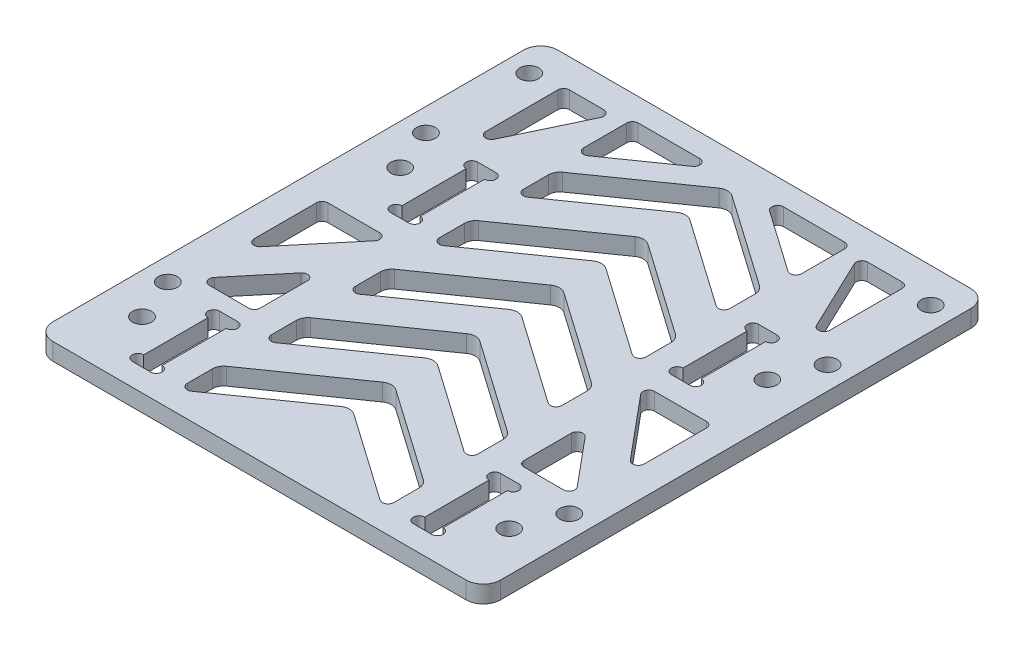
from build123d import *

# Parameters (mm, degrees)
SKETCH_1_R          = 1.65
SKETCH_1_W          = 3.2
SKETCH_1_H          = 15.2
EXTRUDE_1_DEPTH     = 3
SKETCH_2_R          = 1
CUT_EXTRUDE_1_DEPTH = 10
CUT_EXTRUDE_2_DEPTH = 10
CUT_EXTRUDE_4_DEPTH = 10
FILLET_3_R          = 1
FILLET_4_R          = 2


with BuildPart() as part:
    # 草图1 → 凸台-拉伸1 (new body)
    with BuildSketch(Plane(origin=(0, 0, 0), x_dir=(1, 0, 0), z_dir=(0, 1, 0))):
        with BuildLine():
            Line((-36, -34), (36, -34))
            ThreePointArc((36, -34), (38.121320344, -33.121320344), (39, -31))
            Line((39, -31), (39, 51))
            ThreePointArc((39, 51), (38.121320344, 53.121320344), (36, 54))
            Line((36, 54), (-36, 54))
            ThreePointArc((-36, 54), (-38.121320344, 53.121320344), (-39, 51))
            Line((-39, 51), (-39, -31))
            ThreePointArc((-39, -31), (-38.121320344, -33.121320344), (-36, -34))
        make_face()
        with Locations(Location((-32, 22.5, 0), (0, 0, 270))):
            Circle(SKETCH_1_R, mode=Mode.SUBTRACT)
        with Locations(Location((32, 22.5, 0), (0, 0, 270))):
            Circle(SKETCH_1_R, mode=Mode.SUBTRACT)
        with Locations(Location((32, -22.5, 0), (0, 0, 270))):
            Circle(SKETCH_1_R, mode=Mode.SUBTRACT)
        with Locations(Location((-32, -22.5, 0), (0, 0, 270))):
            Circle(SKETCH_1_R, mode=Mode.SUBTRACT)
        with Locations(Location((-35, 48, 0), (0, 0, 270))):
            Circle(SKETCH_1_R, mode=Mode.SUBTRACT)
        with Locations(Location((35, 48, 0), (0, 0, 270))):
            Circle(SKETCH_1_R, mode=Mode.SUBTRACT)
        with Locations(Location((-35, 30, 0), (0, 0, 270))):
            Circle(SKETCH_1_R, mode=Mode.SUBTRACT)
        with Locations(Location((35, 30, 0), (0, 0, 270))):
            Circle(SKETCH_1_R, mode=Mode.SUBTRACT)
        with Locations(Location((35, -15, 0), (0, 0, 270))):
            Circle(SKETCH_1_R, mode=Mode.SUBTRACT)
        with Locations(Location((-35, -15, 0), (0, 0, 270))):
            Circle(SKETCH_1_R, mode=Mode.SUBTRACT)
        with Locations((24.5, 22.5)):
            Rectangle(SKETCH_1_W, SKETCH_1_H, mode=Mode.SUBTRACT)
        with Locations((-24.5, 22.5)):
            Rectangle(SKETCH_1_W, SKETCH_1_H, mode=Mode.SUBTRACT)
        with Locations((24.5, -22.5)):
            Rectangle(SKETCH_1_W, SKETCH_1_H, mode=Mode.SUBTRACT)
        with Locations((-24.5, -22.5)):
            Rectangle(SKETCH_1_W, SKETCH_1_H, mode=Mode.SUBTRACT)
    extrude(amount=EXTRUDE_1_DEPTH)

    # 草图2 → 切除-拉伸1 (cut)
    with BuildSketch(Plane(origin=(0, 3, 0), x_dir=(1, 0, 0), z_dir=(0, 1, 0))):
        with Locations((-22.9, -29.1)):
            Circle(SKETCH_2_R)
        with Locations((-26.1, -29.1)):
            Circle(SKETCH_2_R)
        with Locations((-22.9, -15.9)):
            Circle(SKETCH_2_R)
        with Locations((-26.1, -15.9)):
            Circle(SKETCH_2_R)
        with Locations((26.1, -15.9)):
            Circle(SKETCH_2_R)
        with Locations((22.9, -15.9)):
            Circle(SKETCH_2_R)
        with Locations((26.1, -29.1)):
            Circle(SKETCH_2_R)
        with Locations((22.9, -29.1)):
            Circle(SKETCH_2_R)
        with Locations((22.9, 29.1)):
            Circle(SKETCH_2_R)
        with Locations((26.1, 29.1)):
            Circle(SKETCH_2_R)
        with Locations((22.9, 15.9)):
            Circle(SKETCH_2_R)
        with Locations((26.1, 15.9)):
            Circle(SKETCH_2_R)
        with Locations((-26.1, 15.9)):
            Circle(SKETCH_2_R)
        with Locations((-22.9, 15.9)):
            Circle(SKETCH_2_R)
        with Locations((-26.1, 29.1)):
            Circle(SKETCH_2_R)
        with Locations((-22.9, 29.1)):
            Circle(SKETCH_2_R)
    extrude(amount=-CUT_EXTRUDE_1_DEPTH, mode=Mode.SUBTRACT)

    # 草图3 → 切除-拉伸2 (cut)
    with BuildSketch(Plane.XZ):
        with BuildLine():
            Line((-30.864958387, 11.9), (-24, 11.9))
            ThreePointArc((-24, 11.9), (-23.292893219, 11.607106781), (-23, 10.9))
            Line((-23, 10.9), (-23, 2.662049935))
            ThreePointArc((-23, 2.662049935), (-23.659574736, 1.721778357), (-24.76822128, 2.021865536))
            Line((-24.76822128, 2.021865536), (-31.633179667, 10.2598156))
            ThreePointArc((-31.633179667, 10.2598156), (-31.770547809, 11.324155396), (-30.864958387, 11.9))
        make_face()
        with BuildLine():
            Line((-32.23177872, 1.605834853), (-23.177070009, -9.2598156))
            ThreePointArc((-23.177070009, -9.2598156), (-23.039701867, -10.324155396), (-23.945291289, -10.9))
            Line((-23.945291289, -10.9), (-33, -10.9))
            ThreePointArc((-33, -10.9), (-33.707106781, -10.607106781), (-34, -9.9))
            Line((-34, -9.9), (-34, 0.965650454))
            ThreePointArc((-34, 0.965650454), (-33.340425264, 1.905922031), (-32.23177872, 1.605834853))
        make_face()
        with BuildLine():
            Line((34, -9.9), (34, 0.965650454))
            ThreePointArc((34, 0.965650454), (33.340425264, 1.905922031), (32.23177872, 1.605834853))
            Line((32.23177872, 1.605834853), (23.177070009, -9.2598156))
            ThreePointArc((23.177070009, -9.2598156), (23.039701867, -10.324155396), (23.945291289, -10.9))
            Line((23.945291289, -10.9), (33, -10.9))
            ThreePointArc((33, -10.9), (33.707106781, -10.607106781), (34, -9.9))
        make_face()
        with BuildLine():
            Line((24.76822128, 2.021865536), (31.633179667, 10.2598156))
            ThreePointArc((31.633179667, 10.2598156), (31.770547809, 11.324155396), (30.864958387, 11.9))
            Line((30.864958387, 11.9), (24, 11.9))
            ThreePointArc((24, 11.9), (23.292893219, 11.607106781), (23, 10.9))
            Line((23, 10.9), (23, 2.662049935))
            ThreePointArc((23, 2.662049935), (23.659574736, 1.721778357), (24.76822128, 2.021865536))
        make_face()
        with BuildLine():
            Line((-28.097400841, -34.989212962), (-22.097400841, -47.569517993))
            ThreePointArc((-22.097400841, -47.569517993), (-22.154280777, -48.533628145), (-23, -49))
            Line((-23, -49), (-29, -49))
            ThreePointArc((-29, -49), (-29.707106781, -48.707106781), (-30, -48))
            Line((-30, -48), (-30, -35.419694969))
            ThreePointArc((-30, -35.419694969), (-29.220681718, -34.444349092), (-28.097400841, -34.989212962))
        make_face()
        with BuildLine():
            Line((23, -49), (29, -49))
            ThreePointArc((29, -49), (29.707106781, -48.707106781), (30, -48))
            Line((30, -48), (30, -35.419694969))
            ThreePointArc((30, -35.419694969), (29.220681718, -34.444349092), (28.097400841, -34.989212962))
            Line((28.097400841, -34.989212962), (22.097400841, -47.569517993))
            ThreePointArc((22.097400841, -47.569517993), (22.154280777, -48.533628145), (23, -49))
        make_face()
    extrude(amount=-CUT_EXTRUDE_2_DEPTH, mode=Mode.SUBTRACT)

    # 草图4 → 切除-拉伸4 (cut)
    with BuildSketch(Plane(origin=(0, 0, 0), x_dir=(-1, 0, 0), z_dir=(0, 1, 0))):
        Polygon((0, -48), (18, -35.396264312), (18, -28.07161678), (0, -40.675352467), (-18, -28.07161678), (-18, -35.396264312), align=None)
        with BuildLine():
            Line((18, -50), (7.289085971, -50))
            ThreePointArc((7.289085971, -50), (6.335369021, -49.3007058), (6.715509535, -48.180847956))
            Line((6.715509535, -48.180847956), (17.426423564, -40.680985212))
            ThreePointArc((17.426423564, -40.680985212), (18.461748613, -40.613126423), (19, -41.500137256))
            Line((19, -41.500137256), (19, -49))
            ThreePointArc((19, -49), (18.707106781, -49.707106781), (18, -50))
        make_face()
        with BuildLine():
            Line((-6.715509535, -48.180847956), (-17.426423564, -40.680985212))
            ThreePointArc((-17.426423564, -40.680985212), (-18.461748613, -40.613126423), (-19, -41.500137256))
            Line((-19, -41.500137256), (-19, -49))
            ThreePointArc((-19, -49), (-18.707106781, -49.707106781), (-18, -50))
            Line((-18, -50), (-7.289085971, -50))
            ThreePointArc((-7.289085971, -50), (-6.335369021, -49.3007058), (-6.715509535, -48.180847956))
        make_face()
        with BuildLine():
            Line((-17.147152873, -21.344139235), (-1.147152873, -32.547459846))
            ThreePointArc((-1.147152873, -32.547459846), (0, -32.909155757), (1.147152873, -32.547459846))
            Line((1.147152873, -32.547459846), (17.147152873, -21.344139235))
            ThreePointArc((17.147152873, -21.344139235), (17.774021666, -20.629332372), (18, -19.705835146))
            Line((18, -19.705835146), (18, -15.343303841))
            ThreePointArc((18, -15.343303841), (17.461748613, -14.456293008), (16.426423564, -14.524151797))
            Line((16.426423564, -14.524151797), (1.147152873, -25.222812313))
            ThreePointArc((1.147152873, -25.222812313), (0, -25.584508225), (-1.147152873, -25.222812313))
            Line((-1.147152873, -25.222812313), (-16.426423564, -14.524151797))
            ThreePointArc((-16.426423564, -14.524151797), (-17.461748613, -14.456293008), (-18, -15.343303841))
            Line((-18, -15.343303841), (-18, -19.705835146))
            ThreePointArc((-18, -19.705835146), (-17.774021666, -20.629332372), (-17.147152873, -21.344139235))
        make_face()
        with BuildLine():
            Line((-17.147152873, -6.694844169), (-1.147152873, -17.898164781))
            ThreePointArc((-1.147152873, -17.898164781), (0, -18.259860692), (1.147152873, -17.898164781))
            Line((1.147152873, -17.898164781), (17.147152873, -6.694844169))
            ThreePointArc((17.147152873, -6.694844169), (17.774021666, -5.980037307), (18, -5.056540081))
            Line((18, -5.056540081), (18, -0.694008776))
            ThreePointArc((18, -0.694008776), (17.461748613, 0.193002057), (16.426423564, 0.125143268))
            Line((16.426423564, 0.125143268), (1.147152873, -10.573517248))
            ThreePointArc((1.147152873, -10.573517248), (0, -10.93521316), (-1.147152873, -10.573517248))
            Line((-1.147152873, -10.573517248), (-16.426423564, 0.125143268))
            ThreePointArc((-16.426423564, 0.125143268), (-17.461748613, 0.193002057), (-18, -0.694008776))
            Line((-18, -0.694008776), (-18, -5.056540081))
            ThreePointArc((-18, -5.056540081), (-17.774021666, -5.980037307), (-17.147152873, -6.694844169))
        make_face()
        with BuildLine():
            Line((-17.147152873, 7.954450896), (-1.147152873, -3.248869716))
            ThreePointArc((-1.147152873, -3.248869716), (0, -3.610565627), (1.147152873, -3.248869716))
            Line((1.147152873, -3.248869716), (17.147152873, 7.954450896))
            ThreePointArc((17.147152873, 7.954450896), (17.774021666, 8.669257758), (18, 9.592754984))
            Line((18, 9.592754984), (18, 13.955286289))
            ThreePointArc((18, 13.955286289), (17.461748613, 14.842297122), (16.426423564, 14.774438333))
            Line((16.426423564, 14.774438333), (1.147152873, 4.075777817))
            ThreePointArc((1.147152873, 4.075777817), (0, 3.714081906), (-1.147152873, 4.075777817))
            Line((-1.147152873, 4.075777817), (-16.426423564, 14.774438333))
            ThreePointArc((-16.426423564, 14.774438333), (-17.461748613, 14.842297122), (-18, 13.955286289))
            Line((-18, 13.955286289), (-18, 9.592754984))
            ThreePointArc((-18, 9.592754984), (-17.774021666, 8.669257758), (-17.147152873, 7.954450896))
        make_face()
        with BuildLine():
            Line((-17.147152873, 22.603745961), (-1.147152873, 11.400425349))
            ThreePointArc((-1.147152873, 11.400425349), (0, 11.038729438), (1.147152873, 11.400425349))
            Line((1.147152873, 11.400425349), (17.147152873, 22.603745961))
            ThreePointArc((17.147152873, 22.603745961), (17.774021666, 23.318552823), (18, 24.242050049))
            Line((18, 24.242050049), (18, 28.604581354))
            ThreePointArc((18, 28.604581354), (17.461748613, 29.491592187), (16.426423564, 29.423733398))
            Line((16.426423564, 29.423733398), (1.147152873, 18.725072882))
            ThreePointArc((1.147152873, 18.725072882), (0, 18.363376971), (-1.147152873, 18.725072882))
            Line((-1.147152873, 18.725072882), (-16.426423564, 29.423733398))
            ThreePointArc((-16.426423564, 29.423733398), (-17.461748613, 29.491592187), (-18, 28.604581354))
            Line((-18, 28.604581354), (-18, 24.242050049))
            ThreePointArc((-18, 24.242050049), (-17.774021666, 23.318552823), (-17.147152873, 22.603745961))
        make_face()
    extrude(amount=CUT_EXTRUDE_4_DEPTH, mode=Mode.SUBTRACT)

    # 圆角3
    fillet_3_edges = [part.edges().sort_by_distance(p)[0] for p in [
        (-18, 1.5, -28.07161678),
        (18, 1.5, -28.07161678),
    ]]
    fillet(fillet_3_edges, radius=FILLET_3_R)

    # 圆角4
    fillet_4_edges = [part.edges().sort_by_distance(p)[0] for p in [
        (18, 1.5, -35.396264312),
        (0, 1.5, -48),
        (-18, 1.5, -35.396264312),
        (0, 1.5, -40.675352467),
    ]]
    fillet(fillet_4_edges, radius=FILLET_4_R)


solid = part.part
